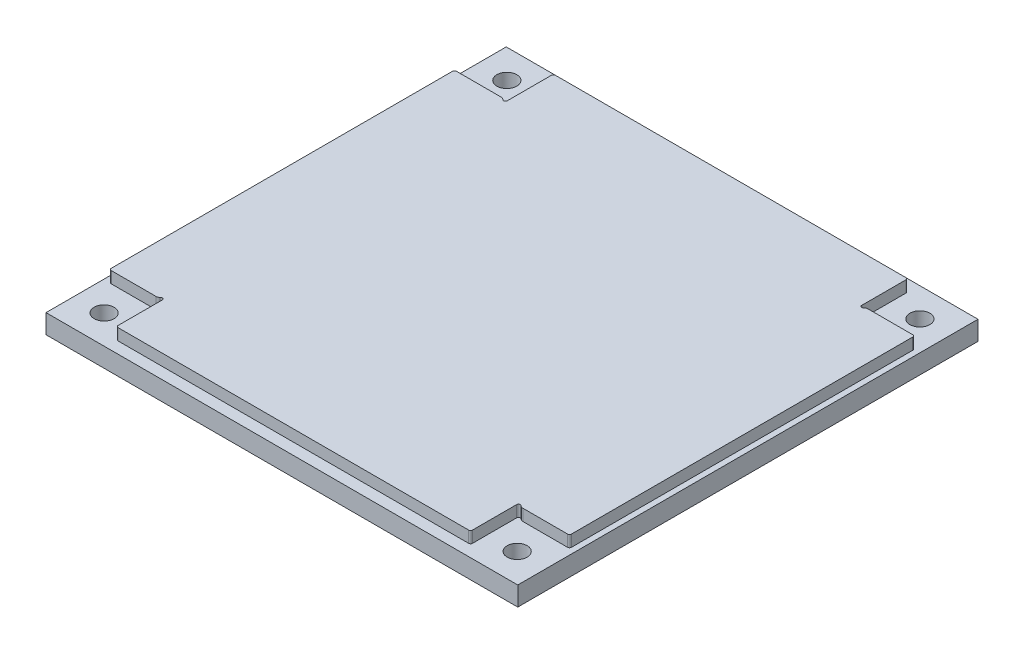
from build123d import *

# Parameters (mm, degrees)
SKETCH_1_W          = 120
SKETCH_1_H          = 120
EXTRUDE_1_DEPTH     = 3
SKETCH_3_W          = 123
SKETCH_3_H          = 120
EXTRUDE_2_DEPTH     = 5
SKETCH_5_W          = 15.3
SKETCH_5_H          = 15
CUT_EXTRUDE_2_DEPTH = 3
SKETCH_6_R          = 2.6
CUT_EXTRUDE_3_DEPTH = 87.291656607
SKETCH_7_R          = 5.5
CUT_EXTRUDE_4_DEPTH = 1
SKETCH_8_W          = 92.4
SKETCH_8_H          = 3
CUT_EXTRUDE_5_DEPTH = 3
SKETCH_9_R          = 0.5
CUT_EXTRUDE_6_DEPTH = 3
FILLET_1_R          = 1
FILLET_2_R          = 0.5


with BuildPart() as part:
    # 草图1 → 凸台-拉伸1 (new body)
    with BuildSketch(Plane(origin=(0, 0, 0), x_dir=(1, 0, 0), z_dir=(0, 1, 0))):
        Rectangle(SKETCH_1_W, SKETCH_1_H)
    extrude(amount=EXTRUDE_1_DEPTH)

    # 草图3 → 凸台-拉伸2 (add)
    with BuildSketch(Plane.XZ):
        Rectangle(SKETCH_3_W, SKETCH_3_H)
    extrude(amount=EXTRUDE_2_DEPTH)

    # 草图5 → 切除-拉伸2 (cut)
    with BuildSketch(Plane(origin=(0, 3, 0), x_dir=(1, 0, 0), z_dir=(0, 1, 0))):
        with Locations((-53.85, 52.5)):
            Rectangle(SKETCH_5_W, SKETCH_5_H)
        with Locations((53.85, 52.5)):
            Rectangle(SKETCH_5_W, SKETCH_5_H)
        with Locations((-53.85, -52.5)):
            Rectangle(SKETCH_5_W, SKETCH_5_H)
        with Locations((53.85, -52.5)):
            Rectangle(SKETCH_5_W, SKETCH_5_H)
    extrude(amount=-CUT_EXTRUDE_2_DEPTH, mode=Mode.SUBTRACT)

    # 草图6 → 切除-拉伸3 (cut, through all)
    with BuildSketch(Plane(origin=(0, 3, 0), x_dir=(1, 0, 0), z_dir=(0, 1, 0))):
        with Locations(Location((-53.85, 52.5, 0), (0, 0, 270))):
            Circle(SKETCH_6_R)
        with Locations(Location((53.85, 52.5, 0), (0, 0, 270))):
            Circle(SKETCH_6_R)
        with Locations(Location((-53.85, -52.5, 0), (0, 0, 270))):
            Circle(SKETCH_6_R)
        with Locations(Location((53.85, -52.5, 0), (0, 0, 270))):
            Circle(SKETCH_6_R)
    extrude(amount=-CUT_EXTRUDE_3_DEPTH, mode=Mode.SUBTRACT)

    # 草图7 → 切除-拉伸4 (cut)
    with BuildSketch(Plane.XZ.offset(5)):
        with Locations(Location((-53.85, 52.5, 0), (0, 0, 270))):
            Circle(SKETCH_7_R)
        with Locations(Location((-53.85, -52.5, 0), (0, 0, 270))):
            Circle(SKETCH_7_R)
        with Locations(Location((53.85, 52.5, 0), (0, 0, 270))):
            Circle(SKETCH_7_R)
        with Locations(Location((53.85, -52.5, 0), (0, 0, 270))):
            Circle(SKETCH_7_R)
    extrude(amount=-CUT_EXTRUDE_4_DEPTH, mode=Mode.SUBTRACT)

    # 草图8 → 切除-拉伸5 (cut)
    with BuildSketch(Plane(origin=(0, 3, 0), x_dir=(1, 0, 0), z_dir=(0, 1, 0))):
        with Locations((0, 58.5)):
            Rectangle(SKETCH_8_W, SKETCH_8_H)
        with Locations((0, -58.5)):
            Rectangle(SKETCH_8_W, SKETCH_8_H)
    extrude(amount=-CUT_EXTRUDE_5_DEPTH, mode=Mode.SUBTRACT)

    # 草图9 → 切除-拉伸6 (cut)
    with BuildSketch(Plane(origin=(0, 3, 0), x_dir=(1, 0, 0), z_dir=(0, 1, 0))):
        with Locations((-46.7, 45)):
            Circle(SKETCH_9_R)
        with Locations((46.7, 45)):
            Circle(SKETCH_9_R)
        with Locations((-46.7, -45)):
            Circle(SKETCH_9_R)
        with Locations((46.7, -45)):
            Circle(SKETCH_9_R)
    extrude(amount=-CUT_EXTRUDE_6_DEPTH, mode=Mode.SUBTRACT)

    # 圆角1
    fillet_1_edges = [part.edges().sort_by_distance(p)[0] for p in [
        (47.2, 1.5, -45),
        (-47.2, 1.5, 45),
        (47.2, 1.5, 45),
        (-47.2, 1.5, -45),
    ]]
    fillet(fillet_1_edges, radius=FILLET_1_R)

    # 圆角2
    fillet_2_edges = [part.edges().sort_by_distance(p)[0] for p in [
        (46.2, 1.5, -57),
        (-46.2, 1.5, -57),
        (-46.2, 1.5, 57),
        (46.2, 1.5, 57),
        (60, 1.5, -45),
        (-60, 1.5, 45),
        (60, 1.5, 45),
        (-60, 1.5, -45),
    ]]
    fillet(fillet_2_edges, radius=FILLET_2_R)


solid = part.part
